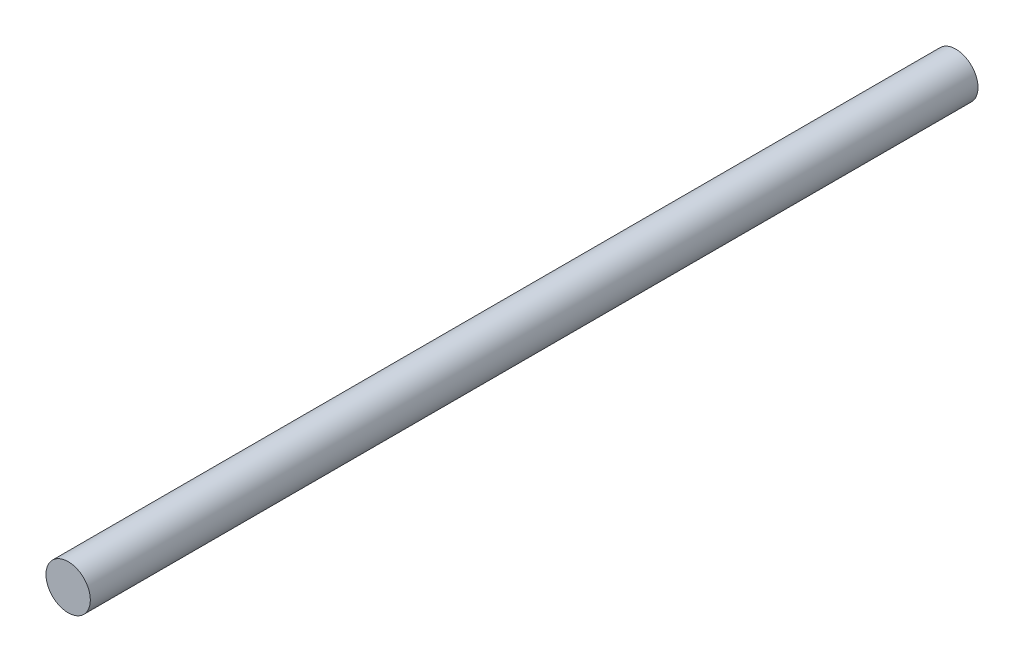
from build123d import *

# Parameters (mm, degrees)
SKETCH_1_R        = 2
EXTRUDE_303_DEPTH = 80


with BuildPart() as part:
    # Эскиз1 → Extrude 303 (new body)
    with BuildSketch(Plane.XY):
        Circle(SKETCH_1_R)
    extrude(amount=EXTRUDE_303_DEPTH)


solid = part.part
